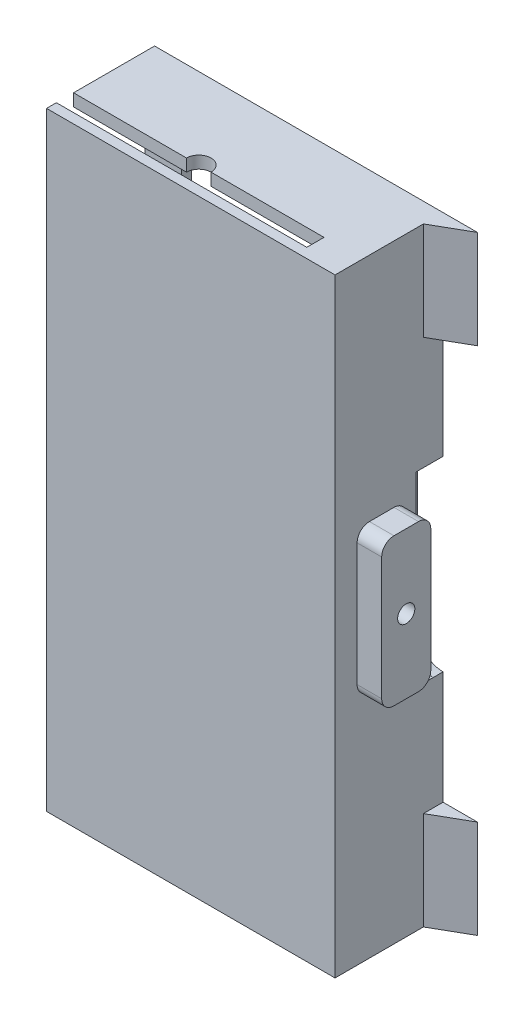
from build123d import *

# Parameters (mm, degrees)
CROQUIS1_W             = 99.2
CROQUIS1_H             = 47
BASE_DEPTH             = 17.6
CROQUIS2_W             = 30.4
CROQUIS2_H             = 14.4
PLATES_DEPTH           = 40.8
CROQUIS4_W             = 2
CROQUIS4_H             = 2.8
WINDOW_LATERAL_1_DEPTH = 40.8
CROQUIS5_R             = 2
WINDOW_LATERAL_2_DEPTH = 2
WINDOW_LATERAL_3_START = -2
WINDOW_LATERAL_3_DEPTH = 2
CROQUIS7_W             = 30.4
CROQUIS7_H             = 2.8
WINDOW_BEHIND_1_DEPTH  = 6.2
WINDOW_BEHIND_2_DEPTH  = 59.973892529
CROQUIS9_R             = 2
WINDOW_BEHIND_3_DEPTH  = 59.973892529
WINDOW_BOTTOM_DEPTH    = 59.973892529
ROTOR_JOIN_1_DEPTH     = 4
CROQUIS12_R            = 1.4
ROTOR_JOIN_2_DEPTH     = 10.2
ROTOR_LIMIT_1_DEPTH    = 16
ROTOR_LIMIT_2_DEPTH    = 16


with BuildPart() as part:
    # Croquis1 → BASE (new body)
    with BuildSketch(Plane(origin=(0, 0, 0), x_dir=(0, 1, 0), z_dir=(0, 0, 1))):
        with Locations((0, 4.1)):
            Rectangle(CROQUIS1_W, CROQUIS1_H)
    extrude(amount=BASE_DEPTH)

    # Croquis2 → PLATES (cut)
    with BuildSketch(Plane(origin=(-27.6, 0, 0), x_dir=(0, -1, 0), z_dir=(-1, 0, 0))):
        with Locations((-32.4, 8.8)):
            Rectangle(CROQUIS2_W, CROQUIS2_H)
        with Locations((0, 8.8)):
            Rectangle(CROQUIS2_W, CROQUIS2_H)
        with Locations((32.4, 8.8)):
            Rectangle(CROQUIS2_W, CROQUIS2_H)
    extrude(amount=-PLATES_DEPTH, mode=Mode.SUBTRACT)

    # Croquis4 → WINDOW_LATERAL_1 (cut)
    with BuildSketch(Plane(origin=(-27.6, 0, 0), x_dir=(0, -1, 0), z_dir=(-1, 0, 0))):
        with Locations((48.6, 14.6)):
            Rectangle(CROQUIS4_W, CROQUIS4_H)
        with Locations((-48.6, 14.6)):
            Rectangle(CROQUIS4_W, CROQUIS4_H)
    extrude(amount=-WINDOW_LATERAL_1_DEPTH, mode=Mode.SUBTRACT)

    # Croquis5 → WINDOW_LATERAL_2 (cut)
    with BuildSketch(Plane.XZ.offset(49.6)):
        with Locations((-7.2, 13.2)):
            Circle(CROQUIS5_R)
    extrude(amount=-WINDOW_LATERAL_2_DEPTH, mode=Mode.SUBTRACT)

    # Croquis6 → WINDOW_LATERAL_3 (cut)
    with BuildSketch(Plane(origin=(0, 49.6, 0), x_dir=(-1, 0, 0), z_dir=(0, 1, 0)).offset(WINDOW_LATERAL_3_START)):
        with BuildLine():
            Line((9.2, 13.2), (5.2, 13.2))
            ThreePointArc((5.2, 13.2), (7.2, 11.2), (9.2, 13.2))
        make_face()
    extrude(amount=WINDOW_LATERAL_3_DEPTH, mode=Mode.SUBTRACT)

    # Croquis7 → WINDOW_BEHIND_1 (cut)
    with BuildSketch(Plane(origin=(13.2, 0, 0), x_dir=(0, -1, 0), z_dir=(-1, 0, 0))):
        with Locations((0, 3)):
            Rectangle(CROQUIS7_W, CROQUIS7_H)
    extrude(amount=-WINDOW_BEHIND_1_DEPTH, mode=Mode.SUBTRACT)

    # Croquis8 → WINDOW_BEHIND_2 (cut, through all)
    with BuildSketch(Plane.XY.offset(1.6)):
        with BuildLine():
            Line((15.2, -11), (15.2, 11))
            ThreePointArc((15.2, 11), (19.4, 15.2), (23.6, 11))
            Line((23.6, 11), (23.6, -11))
            ThreePointArc((23.6, -11), (19.4, -15.2), (15.2, -11))
        make_face()
    extrude(amount=-WINDOW_BEHIND_2_DEPTH, mode=Mode.SUBTRACT)

    # Croquis9 → WINDOW_BEHIND_3 (cut, through all)
    with BuildSketch(Plane.XY.offset(1.6)):
        with Locations((15.2, 0)):
            Circle(CROQUIS9_R)
    extrude(amount=-WINDOW_BEHIND_3_DEPTH, mode=Mode.SUBTRACT)

    # Croquis10 → WINDOW_BOTTOM (cut, through all)
    with BuildSketch(Plane.XY.offset(1.6)):
        with BuildLine():
            Line((5.2, 11.2), (-19.6, 11.2))
            ThreePointArc((-19.6, 11.2), (-21.014213562, 10.614213562), (-21.6, 9.2))
            Line((-21.6, 9.2), (-21.6, -9.2))
            ThreePointArc((-21.6, -9.2), (-21.014213562, -10.614213562), (-19.6, -11.2))
            Line((-19.6, -11.2), (5.2, -11.2))
            ThreePointArc((5.2, -11.2), (6.614213562, -10.614213562), (7.2, -9.2))
            Line((7.2, -9.2), (7.2, 9.2))
            ThreePointArc((7.2, 9.2), (6.614213562, 10.614213562), (5.2, 11.2))
        make_face()
        with BuildLine():
            Line((7.2, 41.6), (7.2, 23.2))
            ThreePointArc((7.2, 23.2), (6.614213562, 21.785786438), (5.2, 21.2))
            Line((5.2, 21.2), (-19.6, 21.2))
            ThreePointArc((-19.6, 21.2), (-21.014213562, 21.785786438), (-21.6, 23.2))
            Line((-21.6, 23.2), (-21.6, 41.6))
            ThreePointArc((-21.6, 41.6), (-21.014213562, 43.014213562), (-19.6, 43.6))
            Line((-19.6, 43.6), (5.2, 43.6))
            ThreePointArc((5.2, 43.6), (6.614213562, 43.014213562), (7.2, 41.6))
        make_face()
        with BuildLine():
            Line((5.2, -21.2), (-19.6, -21.2))
            ThreePointArc((-19.6, -21.2), (-21.014213562, -21.785786438), (-21.6, -23.2))
            Line((-21.6, -23.2), (-21.6, -41.6))
            ThreePointArc((-21.6, -41.6), (-21.014213562, -43.014213562), (-19.6, -43.6))
            Line((-19.6, -43.6), (5.2, -43.6))
            ThreePointArc((5.2, -43.6), (6.614213562, -43.014213562), (7.2, -41.6))
            Line((7.2, -41.6), (7.2, -23.2))
            ThreePointArc((7.2, -23.2), (6.614213562, -21.785786438), (5.2, -21.2))
        make_face()
    extrude(amount=-WINDOW_BOTTOM_DEPTH, mode=Mode.SUBTRACT)

    # Croquis11 → ROTOR_JOIN_1 (add)
    with BuildSketch(Plane.YZ.offset(19.4)):
        with BuildLine():
            Line((-10, 14), (10, 14))
            ThreePointArc((10, 14), (11.414213562, 13.414213562), (12, 12))
            Line((12, 12), (12, 8))
            ThreePointArc((12, 8), (11.414213562, 6.585786438), (10, 6))
            Line((10, 6), (-10, 6))
            ThreePointArc((-10, 6), (-11.414213562, 6.585786438), (-12, 8))
            Line((-12, 8), (-12, 12))
            ThreePointArc((-12, 12), (-11.414213562, 13.414213562), (-10, 14))
        make_face()
    extrude(amount=ROTOR_JOIN_1_DEPTH)

    # Croquis12 → ROTOR_JOIN_2 (cut)
    with BuildSketch(Plane.YZ.offset(23.4)):
        with Locations(Location((0, 10, 0), (0, 0, 270))):
            Circle(CROQUIS12_R)
    extrude(amount=-ROTOR_JOIN_2_DEPTH, mode=Mode.SUBTRACT)

    # Croquis14 → ROTOR_LIMIT_1 (add)
    with BuildSketch(Plane.XZ.offset(49.6)):
        Polygon((19.4, 0), (19.4, 3.2), (25, 0), align=None)
    extrude(amount=-ROTOR_LIMIT_1_DEPTH)

    # Croquis15 → ROTOR_LIMIT_2 (add)
    with BuildSketch(Plane(origin=(0, 49.6, 0), x_dir=(-1, 0, 0), z_dir=(0, 1, 0))):
        Polygon((-25, 0), (-19.4, 0), (-19.4, 3.2), align=None)
    extrude(amount=-ROTOR_LIMIT_2_DEPTH)


solid = part.part
